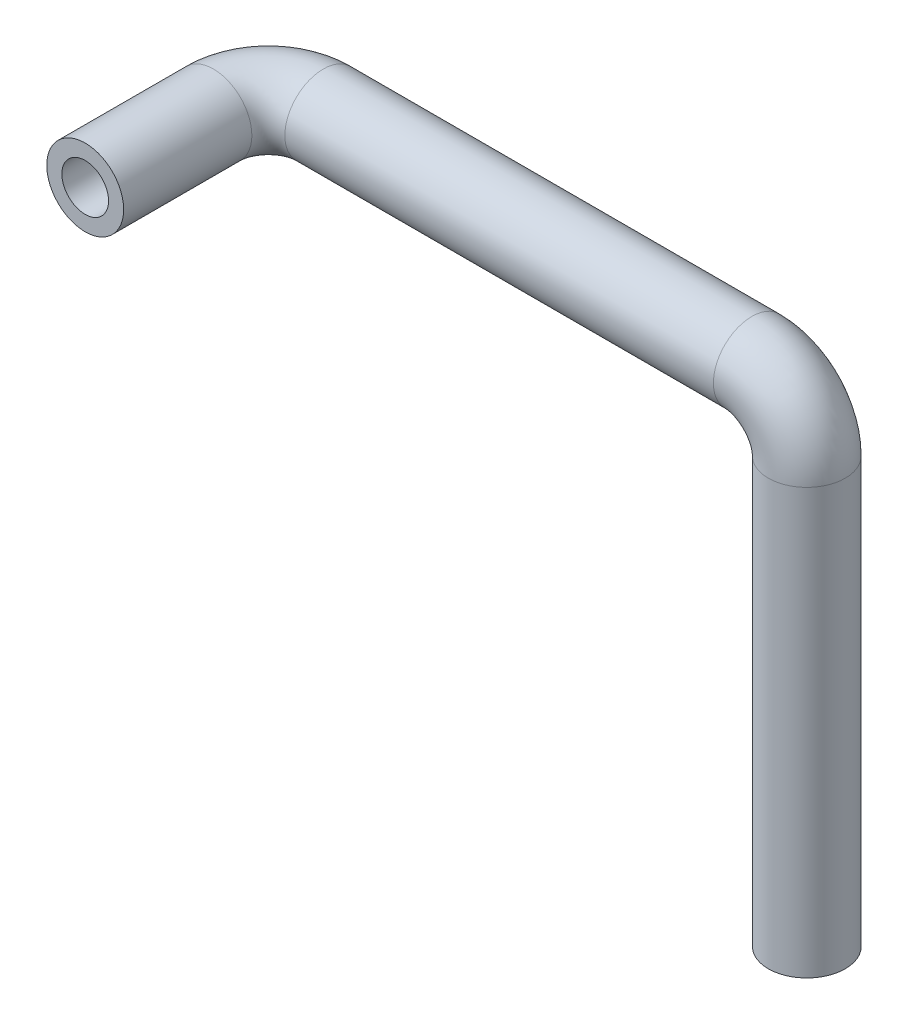
from build123d import *

# Parameters (mm, degrees)
SKETCH1_R   = 10.5
SKETCH1_R_2 = 6.375


with BuildPart() as part:
    # Sweep1: sweep along a curve in space
    with BuildLine() as sweep1_path:
        Line((0, 0, 0), (0, 116, 0))
        ThreePointArc((0, 116, 0), (-4.393398282, 126.606601718, 0), (-15, 131, 0))
        Line((-15, 131, 0), (-132, 131, 0))
        ThreePointArc((-132, 131, 0), (-142.606601718, 131, 4.393398282), (-147, 131, 15))
        Line((-147, 131, 15), (-147, 131, 50))
    # Sketch1 → Sweep1 (sweep)
    with BuildSketch(Plane(origin=(0, 0, 0), x_dir=(1, 0, 0), z_dir=(0, 1, 0))):
        Circle(SKETCH1_R)
        Circle(SKETCH1_R_2, mode=Mode.SUBTRACT)
    sweep(path=sweep1_path.line)


solid = part.part
